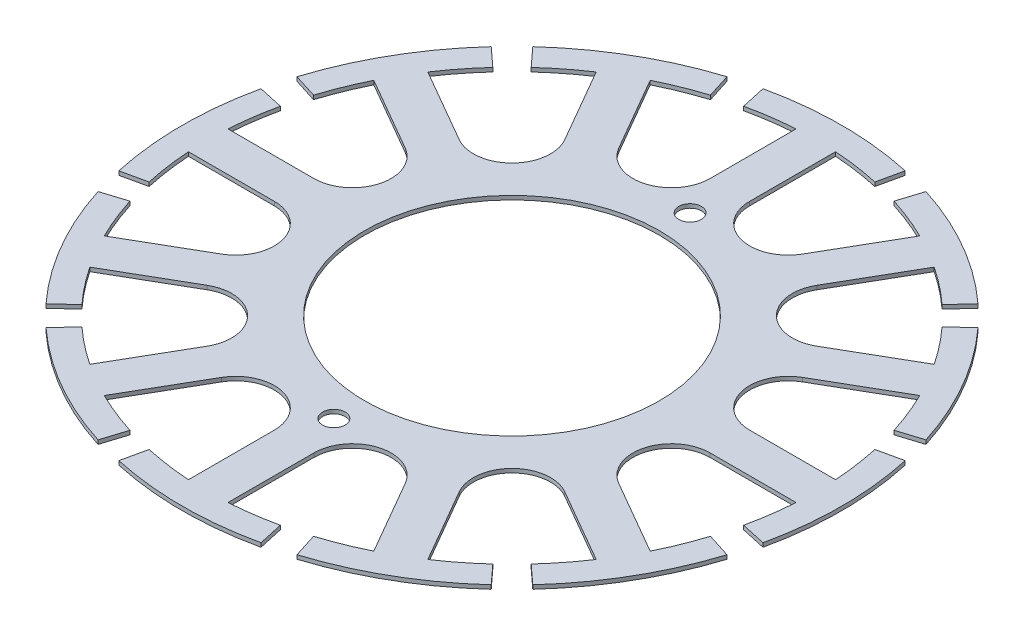
from build123d import *

# Parameters (mm, degrees)
SKETCH2_W               = 16.15
SKETCH2_H               = 0.35
CUT_EXTRUDE5_DEPTH      = 42.296519224
CIRPATTERN1_COUNT       = 12
CUT_EXTRUDE6_DEPTH      = 42.296519224
CUT_EXTRUDE6_DEPTH_BACK = 42.296519224
SKETCH5_R               = 1


with BuildPart() as part:
    # Sketch2 → Revolve2 (revolve)
    with BuildSketch(Plane.XY, mode=Mode.PRIVATE) as revolve2_sk:
        with Locations((21.125, 0.175)):
            Rectangle(SKETCH2_W, SKETCH2_H)
    revolve(revolve2_sk.sketch.rotate(Axis((0, 0, 0), (0, 1, 0)), 90), axis=Axis((0, 0, 0), (0, 1, 0)))

    # Sketch3 → Cut-Extrude5 (cut, symmetric)
    with BuildSketch(Plane(origin=(0, 0.35, 0), x_dir=(1, 0, 0), z_dir=(0, 1, 0))):
        with BuildLine():
            Line((-1.75, 19.287735518), (-1.75, 26.893121797))
            ThreePointArc((-1.75, 26.893121797), (-3.790597968, 26.682088881), (-5.809231237, 26.316446045))
            Line((-5.809231237, 26.316446045), (-6.29423199, 28.51355193))
            ThreePointArc((-6.29423199, 28.51355193), (-7.557516117, 28.205034128), (-8.805811164, 27.840576318))
            Line((-8.805811164, 27.840576318), (-8.127281194, 25.695326431))
            ThreePointArc((-8.127281194, 25.695326431), (-10.058290305, 25.002665781), (-11.931016442, 24.165126663))
            Line((-11.931016442, 24.165126663), (-8.128323302, 17.57866894))
            ThreePointArc((-8.128323302, 17.57866894), (-6.476196083, 16.129792255), (-4.283455194, 15.986072426))
            ThreePointArc((-4.283455194, 15.986072426), (-2.456345798, 17.206907895), (-1.75, 19.287735518))
        make_face()
    cut_extrude5 = extrude(amount=CUT_EXTRUDE5_DEPTH, both=True, mode=Mode.SUBTRACT)

    # CirPattern1: Cut-Extrude5 ×12 about axis
    cirpattern1_axis = Axis((0, 0, 0), (0, 1, 0))
    for i in range(1, CIRPATTERN1_COUNT):
        add(cut_extrude5.rotate(cirpattern1_axis, i * 360 / CIRPATTERN1_COUNT), mode=Mode.SUBTRACT)

    # Sketch5 → Cut-Extrude6 (cut, two sides: drawn at the far end of the back side and taken through both)
    with BuildSketch(Plane(origin=(0, 0.35, 0), x_dir=(1, 0, 0), z_dir=(0, 1, 0)).offset(-CUT_EXTRUDE6_DEPTH_BACK)):
        with Locations(Location((0, 15.765930428, 0), (0, 0, 270))):
            Circle(SKETCH5_R)
        with Locations(Location((0, -15.765930428, 0), (0, 0, 270))):
            Circle(SKETCH5_R)
    extrude(amount=CUT_EXTRUDE6_DEPTH + CUT_EXTRUDE6_DEPTH_BACK, mode=Mode.SUBTRACT)


solid = part.part
